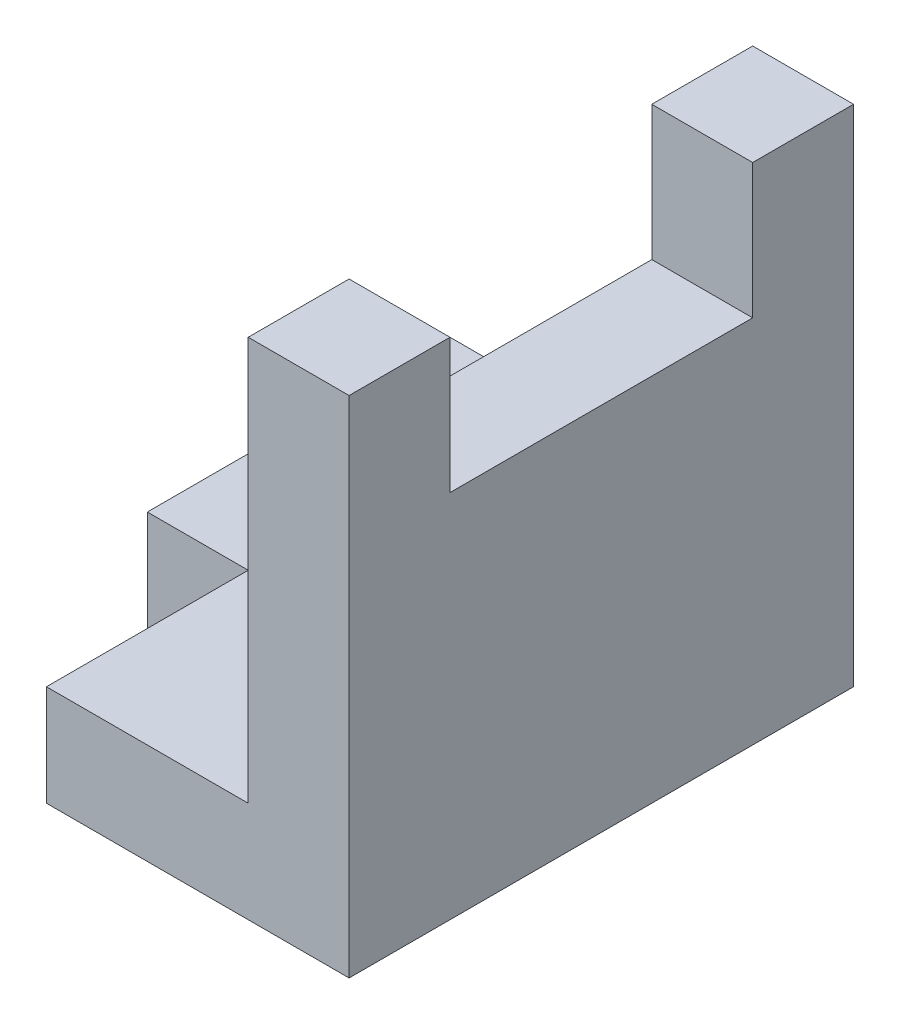
from build123d import *

# Parameters (mm, degrees)
SKETCH6_W           = 381
SKETCH6_H           = 381
SKETCH6_W_2         = 1143
SKETCH6_H_2         = 1524
BOSS_EXTRUDE3_DEPTH = 1905
SKETCH7_W           = 381
SKETCH7_H           = 1143
CUT_EXTRUDE1_DEPTH  = 508
SKETCH9_W           = 381
SKETCH9_H           = 381
CUT_EXTRUDE3_DEPTH  = 762


with BuildPart() as part:
    # Sketch6 → Boss-Extrude3 (new body)
    with BuildSketch(Plane.XY):
        with Locations((-190.5, 190.5)):
            Rectangle(SKETCH6_W, SKETCH6_H)
        with Locations((-952.5, 190.5)):
            Rectangle(SKETCH6_W_2, SKETCH6_H)
        with Locations((-190.5, 1143)):
            Rectangle(SKETCH6_W, SKETCH6_H_2)
    extrude(amount=BOSS_EXTRUDE3_DEPTH)

    # Sketch7 → Cut-Extrude1 (cut)
    with BuildSketch(Plane(origin=(0, 1905, 0), x_dir=(1, 0, 0), z_dir=(0, 1, 0))):
        with Locations((-190.5, -952.5)):
            Rectangle(SKETCH7_W, SKETCH7_H)
    extrude(amount=-CUT_EXTRUDE1_DEPTH, mode=Mode.SUBTRACT)

    # Sketch9 → Cut-Extrude3 (cut)
    with BuildSketch(Plane.XY.offset(1905)):
        with Locations((-1333.5, 190.5)):
            Rectangle(SKETCH9_W, SKETCH9_H)
    extrude(amount=-CUT_EXTRUDE3_DEPTH, mode=Mode.SUBTRACT)


solid = part.part
